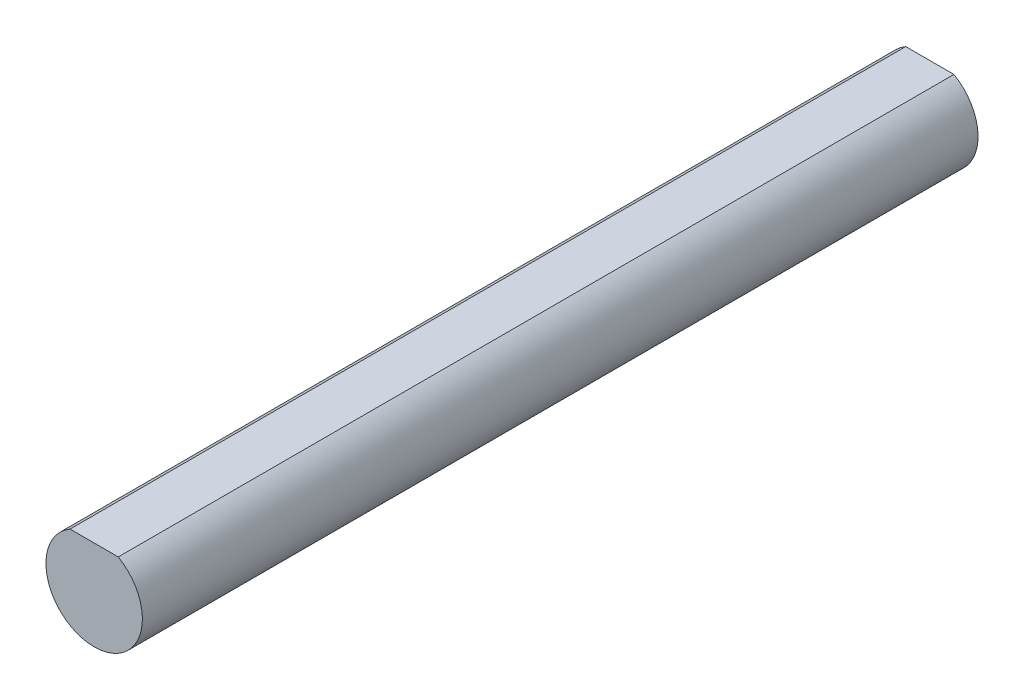
from build123d import *

# Parameters (mm, degrees)
BOSS_EXTRUDE1_DEPTH = 52


with BuildPart() as part:
    # Sketch2 → Boss-Extrude1 (new body)
    with BuildSketch(Plane.XY):
        with BuildLine():
            Line((-1.5, 2.598076211), (1.5, 2.598076211))
            ThreePointArc((1.5, 2.598076211), (0, -3), (-1.5, 2.598076211))
        make_face()
    extrude(amount=BOSS_EXTRUDE1_DEPTH)


solid = part.part
